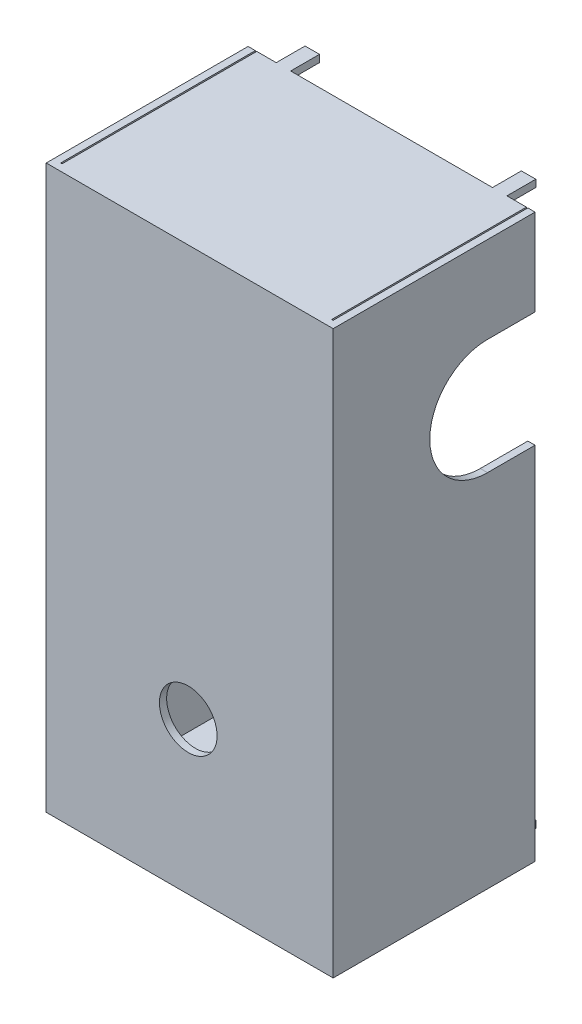
from build123d import *

# Parameters (mm, degrees)
ESQUISSE1_W             = 0.5
ESQUISSE1_H             = 39
EXTRUSION1_DEPTH        = 13.5
ESQUISSE1_W_2           = 18.7
ESQUISSE1_H_2           = 0.5
EXTRUSION1_2_DEPTH      = 13.5
EXTRUSION1_3_DEPTH      = 13.5
EXTRUSION1_4_DEPTH      = 13.5
ESQUISSE2_W             = 19.9
ESQUISSE2_H             = 39
EXTRUSION2_DEPTH        = 0.5
ENL_V_MAT_EXTRU_1_DEPTH = 10
ESQUISSE4_W             = 1
ESQUISSE4_H             = 0.5
EXTRUSION3_DEPTH        = 2
ESQUISSE5_R             = 2
ENL_V_MAT_EXTRU_2_DEPTH = 2


with BuildPart() as part:
    # Esquisse1 → Extrusion1 (new body)
    with BuildSketch(Plane.XY):
        with Locations((-80.79228109, 4.736105473)):
            Rectangle(ESQUISSE1_W, ESQUISSE1_H)
    extrude(amount=EXTRUSION1_DEPTH)



with BuildPart() as body_2:
    # Esquisse1 → Extrusion1 2 (new body)
    with BuildSketch(Plane.XY):
        with Locations((-71.09228109, 23.986105473)):
            Rectangle(ESQUISSE1_W_2, ESQUISSE1_H_2)
    extrude(amount=EXTRUSION1_2_DEPTH)


with BuildPart() as body_3:
    # Esquisse1 → Extrusion1 3 (new body)
    with BuildSketch(Plane.XY):
        with Locations((-61.39228109, 4.736105473)):
            Rectangle(ESQUISSE1_W, ESQUISSE1_H)
    extrude(amount=EXTRUSION1_3_DEPTH)


with BuildPart() as body_4:
    # Esquisse1 → Extrusion1 4 (new body)
    with BuildSketch(Plane.XY):
        with Locations((-71.09228109, -14.513894527)):
            Rectangle(ESQUISSE1_W_2, ESQUISSE1_H_2)
    extrude(amount=EXTRUSION1_4_DEPTH)


with BuildPart() as part_1:
    add(part.part)

    add(body_2.part)  # Extrusion2 merges body 2

    add(body_3.part)  # Extrusion2 merges body 3

    add(body_4.part)  # Extrusion2 merges body 4
    # Esquisse2 → Extrusion2 (add)
    with BuildSketch(Plane.XY.offset(13.5)):
        with Locations((-71.09228109, 4.736105473)):
            Rectangle(ESQUISSE2_W, ESQUISSE2_H)
    extrude(amount=EXTRUSION2_DEPTH)

    # Esquisse3 → Enlèv. mat.-Extru.1 (cut)
    with BuildSketch(Plane(origin=(-61.14228109, 0, 0), x_dir=(0, 0, -1), z_dir=(1, 0, 0))):
        with BuildLine():
            Line((0, 18.236105473), (0, 10.236105473))
            Line((0, 10.236105473), (-3.3, 10.236105473))
            ThreePointArc((-3.3, 10.236105473), (-7.3, 14.236105473), (-3.3, 18.236105473))
            Line((-3.3, 18.236105473), (0, 18.236105473))
        make_face()
    extrude(amount=-ENL_V_MAT_EXTRU_1_DEPTH, mode=Mode.SUBTRACT)

    # Esquisse4 → Extrusion3 (add)
    with BuildSketch(Plane(origin=(0, 0, 0), x_dir=(-1, 0, 0), z_dir=(0, 0, -1))):
        with Locations((63.59228109, 23.986105473)):
            Rectangle(ESQUISSE4_W, ESQUISSE4_H)
        with Locations((78.59228109, 23.986105473)):
            Rectangle(ESQUISSE4_W, ESQUISSE4_H)
        with Locations((63.59228109, -14.513894527)):
            Rectangle(ESQUISSE4_W, ESQUISSE4_H)
        with Locations((78.59228109, -14.513894527)):
            Rectangle(ESQUISSE4_W, ESQUISSE4_H)
    extrude(amount=EXTRUSION3_DEPTH)

    # Esquisse5 → Enlèv. mat.-Extru.2 (cut)
    with BuildSketch(Plane.XY.offset(14)):
        with Locations((-71.19228109, -4.248125646)):
            Circle(ESQUISSE5_R)
    extrude(amount=-ENL_V_MAT_EXTRU_2_DEPTH, mode=Mode.SUBTRACT)


solid = part_1.part
